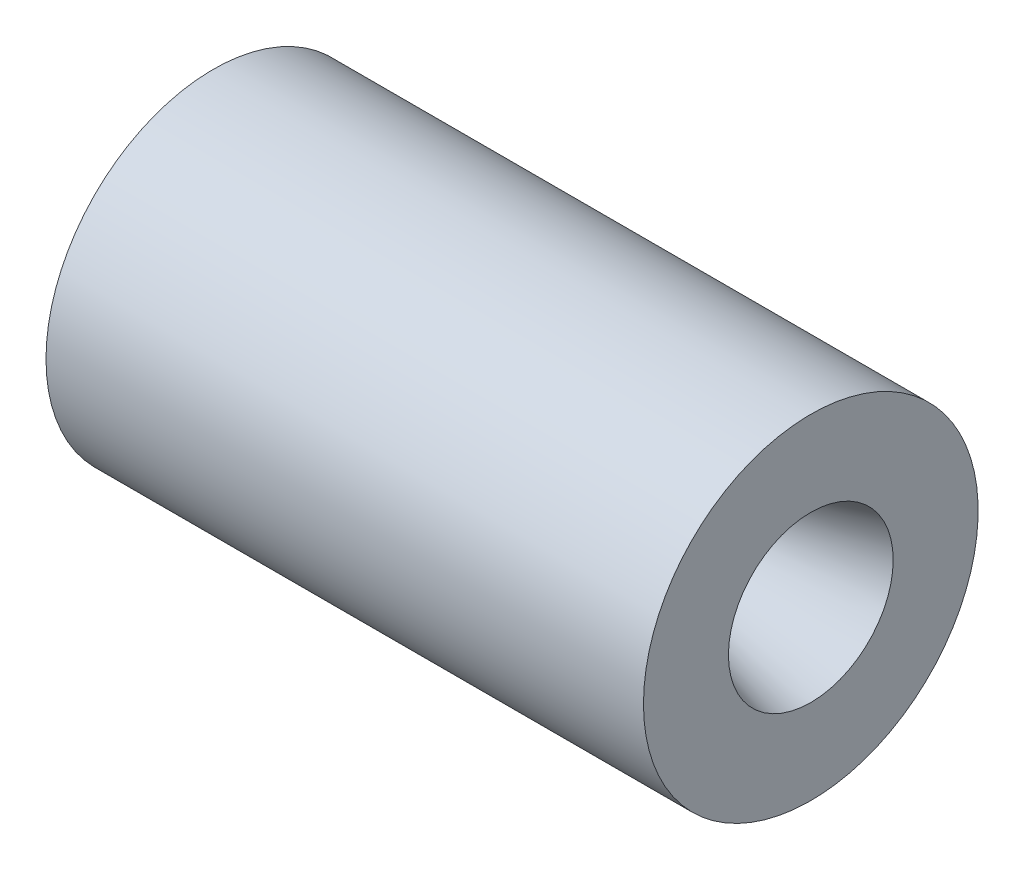
from build123d import *


with BuildPart() as part:
    # Model → Revolve1 (revolve)
    with BuildSketch(Plane.XY, mode=Mode.PRIVATE) as revolve1_sk:
        with BuildLine():
            Line((0, 47.573231), (117.474371, 47.573231))
            ThreePointArc((117.474371, 47.573231), (122.762513596, 46.877033869), (127.690278, 44.835887))
            Line((127.690278, 44.835887), (170.361247243, 20.199791421))
            ThreePointArc((170.361247243, 20.199791421), (176.44612601, 17.679352192), (182.976005243, 16.819677421))
            ThreePointArc((182.976005243, 16.819677421), (183.814650955, 16.874644956), (184.638947243, 17.038607421))
            Line((184.638947243, 17.038607421), (249.383859243, 34.386954421))
            Line((249.383859243, 34.386954421), (249.383859243, 69.85))
            Line((249.383859243, 69.85), (0, 69.85))
            Line((0, 69.85), (0, 47.573231))
        make_face()
    revolve(revolve1_sk.sketch.rotate(Axis((0, 0, 0), (1, 0, 0)), 90), axis=Axis((0, 0, 0), (1, 0, 0)))


solid = part.part
